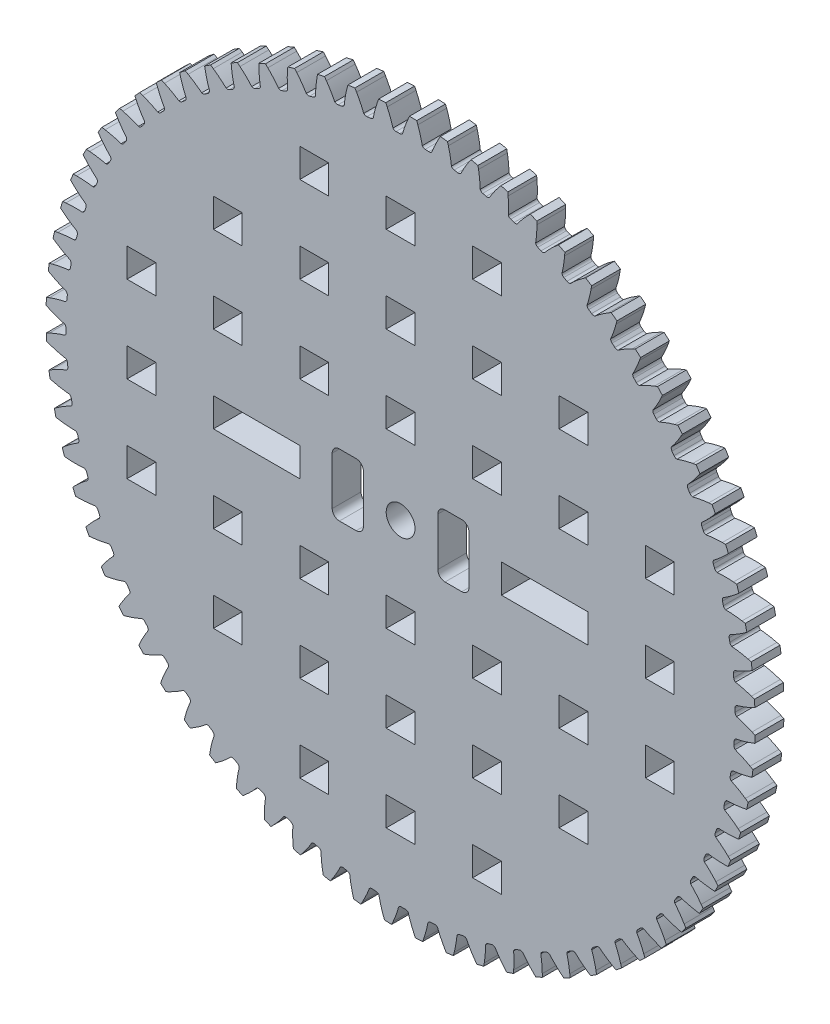
from build123d import *

# Parameters (mm, degrees)
MODEL_R                 = 1.5
MODEL_W                 = 3
MODEL_H                 = 3
MODEL_W_2               = 9
MODEL_H_2               = 2.999999999
SALIENTE_EXTRUIR1_DEPTH = 3


with BuildPart() as part:
    # Model → Saliente-Extruir1 (new body)
    with BuildSketch(Plane.XY):
        with BuildLine():
            Line((66.381105727, 280.580144611), (66.621753071, 280.825617289))
            Line((66.621753071, 280.825617289), (67.312110853, 280.546390046))
            Line((67.312110853, 280.546390046), (67.314437691, 280.202642223))
            ThreePointArc((67.314437691, 280.202642223), (67.28482772, 279.346751176), (67.187378036, 278.495910536))
            ThreePointArc((67.187378036, 278.495910536), (67.266733106, 278.333407592), (67.411213785, 278.224642857))
            Line((67.411213785, 278.224642857), (67.74822325, 278.070904418))
            ThreePointArc((67.74822325, 278.070904418), (67.925068257, 278.033085409), (68.099807783, 278.079674378))
            ThreePointArc((68.099807783, 278.079674378), (68.67849162, 278.710983536), (69.305457569, 279.294370142))
            Line((69.305457569, 279.294370142), (69.566583531, 279.517934925))
            Line((69.566583531, 279.517934925), (70.229978036, 279.17960158))
            Line((70.229978036, 279.17960158), (70.202336423, 278.836959024))
            ThreePointArc((70.202336423, 278.836959024), (70.098243307, 277.98690558), (69.9270088, 277.147795945))
            ThreePointArc((69.9270088, 277.147795945), (69.991898836, 276.978995124), (70.12635025, 276.858051951))
            Line((70.12635025, 276.858051951), (70.448678105, 276.675526223))
            ThreePointArc((70.448678105, 276.675526223), (70.62155402, 276.622438068), (70.799689105, 276.653620199))
            ThreePointArc((70.799689105, 276.653620199), (71.431193094, 277.232091415), (72.106618742, 277.758614377))
            Line((72.106618742, 277.758614377), (72.386235995, 277.958569801))
            Line((72.386235995, 277.958569801), (73.01761839, 277.563705276))
            Line((73.01761839, 277.563705276), (72.960218694, 277.224775703))
            ThreePointArc((72.960218694, 277.224775703), (72.782434645, 276.387029282), (72.538718514, 275.566036783))
            ThreePointArc((72.538718514, 275.566036783), (72.588649663, 275.392222761), (72.712048557, 275.2600216))
            Line((72.712048557, 275.2600216), (73.017241691, 275.050097714))
            ThreePointArc((73.017241691, 275.050097714), (73.184832823, 274.982144447), (73.365007753, 274.997682425))
            ThreePointArc((73.365007753, 274.997682425), (74.044525766, 275.518913184), (74.763270716, 275.984565343))
            Line((74.763270716, 275.984565343), (75.059251204, 276.159389627))
            Line((75.059251204, 276.159389627), (75.653816287, 275.710999079))
            Line((75.653816287, 275.710999079), (75.567095357, 275.378361949))
            ThreePointArc((75.567095357, 275.378361949), (75.316973418, 274.559298306), (75.002630489, 273.762671193))
            ThreePointArc((75.002630489, 273.762671193), (75.037222744, 273.585166799), (75.148629978, 273.442713781))
            Line((75.148629978, 273.442713781), (75.434365689, 273.206989384))
            ThreePointArc((75.434365689, 273.206989384), (75.595396568, 273.12468817), (75.776240102, 273.124463742))
            ThreePointArc((75.776240102, 273.124463742), (76.498600598, 273.584487163), (77.255194765, 273.985724625))
            Line((77.255194765, 273.985724625), (77.565285899, 274.13408725))
            Line((77.565285899, 274.13408725), (78.118508672, 273.635583202))
            Line((78.118508672, 273.635583202), (78.003126504, 273.311770085))
            ThreePointArc((78.003126504, 273.311770085), (77.682570254, 272.51762279), (77.299992868, 271.751423874))
            ThreePointArc((77.299992868, 271.751423874), (77.318982962, 271.571580024), (77.417550659, 271.419959303))
            Line((77.417550659, 271.419959303), (77.681654324, 271.160228401))
            ThreePointArc((77.681654324, 271.160228401), (77.834899409, 271.064205602), (78.015035218, 271.048220475))
            ThreePointArc((78.015035218, 271.048220475), (78.774740597, 271.443535503), (79.563425845, 271.777304608))
            Line((79.563425845, 271.777304608), (79.885267643, 271.898076446))
            Line((79.885267643, 271.898076446), (80.392937745, 271.353252815))
            Line((80.392937745, 271.353252815), (80.249772469, 271.040728122))
            ThreePointArc((80.249772469, 271.040728122), (79.861221535, 270.277541116), (79.413321335, 269.547601634))
            ThreePointArc((79.413321335, 269.547601634), (79.416564742, 269.366787049), (79.501542743, 269.20715255))
            Line((79.501542743, 269.20715255), (79.742004373, 268.925391851))
            ThreePointArc((79.742004373, 268.925391851), (79.886297376, 268.816378258), (80.064354519, 268.784754089))
            ThreePointArc((80.064354519, 268.784754089), (80.855622965, 269.112352138), (81.670396921, 269.376112702))
            Line((81.670396921, 269.376112702), (82.001539973, 269.468374606))
            Line((82.001539973, 269.468374606), (82.459793729, 268.881377828))
            Line((82.459793729, 268.881377828), (82.289934918, 268.582520062))
            ThreePointArc((82.289934918, 268.582520062), (81.836346408, 267.856101658), (81.326532186, 267.167976892))
            ThreePointArc((81.326532186, 267.167976892), (81.314004221, 266.987567679), (81.384745791, 266.821134316))
            Line((81.384745791, 266.821134316), (81.59973533, 266.519488189))
            ThreePointArc((81.59973533, 266.519488189), (81.733978094, 266.398313463), (81.908601447, 266.351290931))
            ThreePointArc((81.908601447, 266.351290931), (82.725410929, 266.608678781), (83.560072672, 266.800423427))
            Line((83.560072672, 266.800423427), (83.89799678, 266.863473228))
            Line((83.89799678, 266.863473228), (84.303346601, 266.238770704))
            Line((84.303346601, 266.238770704), (84.108086984, 265.955854353))
            ThreePointArc((84.108086984, 265.955854353), (83.592912979, 265.271733033), (83.025064729, 264.630660026))
            ThreePointArc((83.025064729, 264.630660026), (82.996860738, 264.452029209), (83.052827492, 264.280063642))
            Line((83.052827492, 264.280063642), (83.240708738, 263.960827797))
            ThreePointArc((83.240708738, 263.960827797), (83.363879595, 263.828414149), (83.53374017, 263.766351124))
            ThreePointArc((83.53374017, 263.766351124), (84.369874274, 263.951569898), (85.218071524, 264.069839334))
            Line((85.218071524, 264.069839334), (85.560204881, 264.103197184))
            Line((85.560204881, 264.103197184), (85.909565812, 263.445543277))
            Line((85.909565812, 263.445543277), (85.690391431, 263.180721505))
            ThreePointArc((85.690391431, 263.180721505), (85.117552718, 262.544103847), (84.495992107, 261.954961553))
            ThreePointArc((84.495992107, 261.954961553), (84.452326739, 261.779468619), (84.493092736, 261.603279609))
            Line((84.493092736, 261.603279609), (84.652435801, 261.268883623))
            ThreePointArc((84.652435801, 261.268883623), (84.763597345, 261.126238802), (84.9274024, 261.04960762))
            ThreePointArc((84.9274024, 261.04960762), (85.776497642, 261.161247692), (86.631775106, 261.205141816))
            Line((86.631775106, 261.205141816), (86.97551387, 261.208553843))
            Line((86.97551387, 261.208553843), (87.266227062, 260.522953696))
            Line((87.266227062, 260.522953696), (87.024805968, 260.278241957))
            ThreePointArc((87.024805968, 260.278241957), (86.398662194, 259.693973005), (85.728119675, 259.161245151))
            ThreePointArc((85.728119675, 259.161245151), (85.66932525, 258.990225709), (85.694580236, 258.81115416))
            Line((85.694580236, 258.81115416), (85.824172421, 258.464142989))
            ThreePointArc((85.824172421, 258.464142989), (85.922478647, 258.312352607), (86.078981527, 258.221736479))
            ThreePointArc((86.078981527, 258.221736479), (86.934575778, 258.258948201), (87.790424279, 258.228132952))
            Line((87.790424279, 258.228132952), (88.133152391, 258.201573187))
            Line((88.133152391, 258.201573187), (88.363005341, 257.493244632))
            Line((88.363005341, 257.493244632), (88.101174894, 257.270505329))
            ThreePointArc((88.101174894, 257.270505329), (87.426491391, 256.743031723), (86.712070198, 256.270772691))
            ThreePointArc((86.712070198, 256.270772691), (86.638594177, 256.105528301), (86.648145946, 255.924937056))
            Line((86.648145946, 255.924937056), (86.747000978, 255.567951664))
            ThreePointArc((86.747000978, 255.567951664), (86.831703715, 255.408170939), (86.979713338, 255.304259508))
            ThreePointArc((86.979713338, 255.304259508), (87.83529501, 255.266759675), (88.685201022, 255.161469576))
            Line((88.685201022, 255.161469576), (89.024310115, 255.105140156))
            Line((89.024310115, 255.105140156), (89.191553504, 254.379474))
            Line((89.191553504, 254.379474), (88.911306392, 254.180402315))
            ThreePointArc((88.911306392, 254.180402315), (88.193217909, 253.713738446), (87.440355217, 253.305542412))
            ThreePointArc((87.440355217, 253.305542412), (87.352756797, 253.147330684), (87.346532655, 252.966594152))
            Line((87.346532655, 252.966594152), (87.413898186, 252.602351414))
            ThreePointArc((87.413898186, 252.602351414), (87.484352796, 252.435796372), (87.62274272, 252.319380467))
            ThreePointArc((87.62274272, 252.319380467), (88.47180032, 252.207454476), (89.309295546, 252.028490847))
            Line((89.309295546, 252.028490847), (89.642204794, 251.942820474))
            Line((89.642204794, 251.942820474), (89.745565799, 251.205339474))
            Line((89.745565799, 251.205339474), (89.449034871, 251.031450462))
            ThreePointArc((89.449034871, 251.031450462), (88.693006495, 250.629147926), (87.907432045, 250.288121508))
            ThreePointArc((87.907432045, 250.288121508), (87.806377903, 250.138146529), (87.784425218, 249.958640224))
            Line((87.784425218, 249.958640224), (87.819788557, 249.589912246))
            ThreePointArc((87.819788557, 249.589912246), (87.875458838, 249.417850472), (88.003175832, 249.289816088))
            ThreePointArc((88.003175832, 249.289816088), (88.839247518, 249.104315764), (89.657958114, 248.853040628))
            Line((89.657958114, 248.853040628), (89.982133876, 248.738681303))
            Line((89.982133876, 248.738681303), (90.020825857, 247.994998136))
            Line((90.020825857, 247.994998136), (89.710267893, 247.847615198))
            ThreePointArc((89.710267893, 247.847615198), (88.922053458, 247.512735758), (88.109745944, 247.241474374))
            ThreePointArc((88.109745944, 247.241474374), (87.996005163, 247.100877544), (87.95849101, 246.923967617))
            Line((87.95849101, 246.923967617), (87.961583019, 246.553560642))
            ThreePointArc((87.961583019, 246.553560642), (88.002045286, 246.377301631), (88.118117347, 246.238623187))
            ThreePointArc((88.118117347, 246.238623187), (88.934840109, 245.980960298), (89.728535193, 245.659286009))
            Line((89.728535193, 245.659286009), (90.041510297, 245.517108077))
            Line((90.041510297, 245.517108077), (90.015238784, 244.772882621))
            Line((90.015238784, 244.772882621), (89.693017317, 244.653127429))
            ThreePointArc((89.693017317, 244.653127429), (88.87861561, 244.388219722), (88.045757184, 244.188787833))
            ThreePointArc((88.045757184, 244.188787833), (87.9201954, 244.058639179), (87.867405283, 243.885672021))
            Line((87.867405283, 243.885672021), (87.838202432, 243.516405071))
            ThreePointArc((87.838202432, 243.516405071), (87.863148743, 243.337290259), (87.966692491, 243.189023182))
            ThreePointArc((87.966692491, 243.189023182), (88.757850576, 242.8611587), (89.52048965, 242.471533394))
            Line((89.52048965, 242.471533394), (89.819882165, 242.302618914))
            Line((89.819882165, 242.302618914), (89.728847101, 241.563515174))
            Line((89.728847101, 241.563515174), (89.397414431, 241.472299138))
            ThreePointArc((89.397414431, 241.472299138), (88.56302354, 241.27937927), (87.715952758, 241.153294675))
            ThreePointArc((87.715952758, 241.153294675), (87.579525571, 241.034584706), (87.511861256, 240.866876702))
            Line((87.511861256, 240.866876702), (87.450585795, 240.50156012))
            ThreePointArc((87.450585795, 240.50156012), (87.459826293, 240.320952681), (87.550053699, 240.164225372))
            ThreePointArc((87.550053699, 240.164225372), (88.309625916, 239.768654542), (89.035404835, 239.314043504))
            Line((89.035404835, 239.314043504), (89.318936204, 239.119678017))
            Line((89.318936204, 239.119678017), (89.163830421, 238.391321018))
            Line((89.163830421, 238.391321018), (88.825708951, 238.329338348))
            ThreePointArc((88.825708951, 238.329338348), (87.977679095, 238.209874556), (87.122842676, 238.158096834))
            ThreePointArc((87.122842676, 238.158096834), (86.976588381, 238.051729005), (86.894564833, 237.890556515))
            Line((86.894564833, 237.890556515), (86.801683105, 237.531970581))
            ThreePointArc((86.801683105, 237.531970581), (86.795147465, 237.351245044), (86.871371843, 237.187250294))
            ThreePointArc((86.871371843, 237.187250294), (87.59357739, 236.72698365), (88.276972538, 236.210846743))
            Line((88.276972538, 236.210846743), (88.542484916, 235.992509489))
            Line((88.542484916, 235.992509489), (88.324488862, 235.280442468))
            Line((88.324488862, 235.280442468), (87.982251901, 235.248164888))
            ThreePointArc((87.982251901, 235.248164888), (87.127037099, 235.203066364), (86.270940865, 235.225989575))
            ThreePointArc((86.270940865, 235.225989575), (86.115972544, 235.132773409), (86.020214012, 234.979363052))
            Line((86.020214012, 234.979363052), (85.896432905, 234.630236822))
            ThreePointArc((85.896432905, 234.630236822), (85.874170866, 234.450768619), (85.935812103, 234.280754526))
            ThreePointArc((85.935812103, 234.280754526), (86.615154558, 233.759294975), (87.250964886, 233.185560313))
            Line((87.250964886, 233.185560313), (87.496437564, 232.944912969))
            Line((87.496437564, 232.944912969), (87.217210321, 232.254555187))
            Line((87.217210321, 232.254555187), (86.873462498, 232.252228349))
            ThreePointArc((86.873462498, 232.252228349), (86.017571451, 232.28183832), (85.166730811, 232.379288004))
            ThreePointArc((85.166730811, 232.379288004), (85.004227867, 232.299932933), (84.895463132, 232.155452255))
            Line((84.895463132, 232.155452255), (84.741724693, 231.81844279))
            ThreePointArc((84.741724693, 231.81844279), (84.703905684, 231.641597783), (84.750494653, 231.466858257))
            ThreePointArc((84.750494653, 231.466858257), (85.38180381, 230.88817442), (85.965190417, 230.26120847))
            Line((85.965190417, 230.26120847), (86.1887552, 230.000082509))
            Line((86.1887552, 230.000082509), (85.850421855, 229.336688004))
            Line((85.850421855, 229.336688004), (85.507779299, 229.364329617))
            ThreePointArc((85.507779299, 229.364329617), (84.657725855, 229.468422733), (83.81861622, 229.63965724))
            ThreePointArc((83.81861622, 229.63965724), (83.649815399, 229.574767204), (83.528872226, 229.440315789))
            Line((83.528872226, 229.440315789), (83.346346498, 229.117987935))
            ThreePointArc((83.346346498, 229.117987935), (83.293258343, 228.94511202), (83.324440474, 228.766976934))
            ThreePointArc((83.324440474, 228.766976934), (83.90291169, 228.135472946), (84.429434651, 227.460047298))
            Line((84.429434651, 227.460047298), (84.629390075, 227.180430045))
            Line((84.629390075, 227.180430045), (84.23452555, 226.54904765))
            Line((84.23452555, 226.54904765), (83.895595978, 226.606447345))
            ThreePointArc((83.895595978, 226.606447345), (83.057849557, 226.784231395), (82.236857058, 227.027947526))
            ThreePointArc((82.236857058, 227.027947526), (82.063043036, 226.978016377), (81.930841875, 226.854617483))
            Line((81.930841875, 226.854617483), (81.720917989, 226.549424348))
            ThreePointArc((81.720917989, 226.549424348), (81.652964722, 226.381833216), (81.6685027, 226.201658287))
            ThreePointArc((81.6685027, 226.201658287), (82.189733459, 225.522140273), (82.655385618, 224.803395324))
            Line((82.655385618, 224.803395324), (82.830209901, 224.507414835))
            Line((82.830209901, 224.507414835), (82.381819354, 223.912849752))
            Line((82.381819354, 223.912849752), (82.049182224, 223.999570683))
            ThreePointArc((82.049182224, 223.999570683), (81.230118581, 224.249692622), (80.433491468, 224.564035551))
            ThreePointArc((80.433491468, 224.564035551), (80.255987074, 224.529443295), (80.113534056, 224.418036062))
            Line((80.113534056, 224.418036062), (79.877809659, 224.132300351))
            ThreePointArc((79.877809659, 224.132300351), (79.795508445, 223.971269472), (79.795284016, 223.790425938))
            ThreePointArc((79.795284016, 223.790425938), (80.255307438, 223.068065442), (80.6565449, 222.311471274))
            Line((80.6565449, 222.311471274), (80.804907525, 222.00138014))
            Line((80.804907525, 222.00138014), (80.306403477, 221.448157368))
            Line((80.306403477, 221.448157368), (79.982590359, 221.563539536))
            ThreePointArc((79.982590359, 221.563539536), (79.188443065, 221.884095785), (78.422244149, 222.266673172))
            ThreePointArc((78.422244149, 222.266673172), (78.242400299, 222.247683078), (78.090779578, 222.149115381))
            Line((78.090779578, 222.149115381), (77.831048676, 221.885011716))
            ThreePointArc((77.831048676, 221.885011716), (77.735025877, 221.731766631), (77.71904075, 221.551630822))
            ThreePointArc((77.71904075, 221.551630822), (78.114355778, 220.791925442), (78.448124883, 220.003240195))
            Line((78.448124883, 220.003240195), (78.568896721, 219.681398397))
            Line((78.568896721, 219.681398397), (78.02407309, 219.173728295))
            Line((78.02407309, 219.173728295), (77.711548397, 219.316893571))
            ThreePointArc((77.711548397, 219.316893571), (76.94836139, 219.705444505), (76.218421909, 220.153344705))
            ThreePointArc((76.218421909, 220.153344705), (76.037607324, 220.150101298), (75.877972825, 220.065123297))
            Line((75.877972825, 220.065123297), (75.596212126, 219.824661666))
            ThreePointArc((75.596212126, 219.824661666), (75.487198533, 219.680368663), (75.455574364, 219.502311521))
            ThreePointArc((75.455574364, 219.502311521), (75.783172413, 218.711043075), (76.046932977, 217.896269119))
            Line((76.046932977, 217.896269119), (76.13919488, 217.565126067))
            Line((76.13919488, 217.565126067), (75.552198103, 217.106872311))
            Line((75.552198103, 217.106872311), (75.253340337, 217.276731122))
            ThreePointArc((75.253340337, 217.276731122), (74.526921933, 217.730319632), (73.838797166, 218.240133854))
            ThreePointArc((73.838797166, 218.240133854), (73.658387954, 218.252661819), (73.491954591, 218.181920249))
            Line((73.491954591, 218.181920249), (73.190308464, 217.96693071))
            ThreePointArc((73.190308464, 217.96693071), (73.069133738, 217.832687946), (73.022111206, 217.658064593))
            ThreePointArc((73.022111206, 217.658064593), (73.279499056, 216.841255111), (73.471243702, 216.006593368))
            Line((73.471243702, 216.006593368), (73.534293503, 215.66866926))
            Line((73.534293503, 215.66866926), (72.909590979, 215.263319438))
            Line((72.909590979, 215.263319438), (72.626674627, 215.458579056))
            ThreePointArc((72.626674627, 215.458579056), (71.942553308, 215.973753061), (71.301480301, 216.541601311))
            ThreePointArc((71.301480301, 216.541601311), (71.122849484, 216.569805302), (70.950883917, 216.513838548))
            Line((70.950883917, 216.513838548), (70.631648071, 216.325957301))
            ThreePointArc((70.631648071, 216.325957301), (70.499234424, 216.202786445), (70.437171398, 216.03292587))
            ThreePointArc((70.437171398, 216.03292587), (70.622390173, 215.196791766), (70.740659609, 214.348594515))
            Line((70.740659609, 214.348594515), (70.774017459, 214.006461159))
            Line((70.774017459, 214.006461159), (70.116363552, 213.657100228))
            Line((70.116363552, 213.657100228), (69.85154178, 213.876274608))
            ThreePointArc((69.85154178, 213.876274608), (69.214924122, 214.449113322), (68.625781828, 215.070673932))
            ThreePointArc((68.625781828, 215.070673932), (68.450288894, 215.1143393), (68.274099884, 215.073573304))
            Line((68.274099884, 215.073573304), (67.939703898, 214.914230239))
            ThreePointArc((67.939703898, 214.914230239), (67.797059077, 214.803068695), (67.720427895, 214.63926364))
            ThreePointArc((67.720427895, 214.63926364), (67.832067967, 213.790168398), (67.875962091, 212.934890934))
            Line((67.875962091, 212.934890934), (67.879374118, 212.59115217))
            Line((67.879374118, 212.59115217), (67.193773971, 212.300438977))
            Line((67.193773971, 212.300438977), (66.949062232, 212.541860071))
            ThreePointArc((66.949062232, 212.541860071), (66.364793279, 213.168003846), (65.832065426, 213.838546364))
            ThreePointArc((65.832065426, 213.838546364), (65.661045984, 213.897340789), (65.481974435, 213.872085804))
            Line((65.481974435, 213.872085804), (65.134963264, 213.742493618))
            ThreePointArc((65.134963264, 213.742493618), (64.983172882, 213.644187393), (64.892556754, 213.487684513))
            ThreePointArc((64.892556754, 213.487684513), (64.929768476, 212.632090262), (64.898953227, 211.776241761))
            Line((64.898953227, 211.776241761), (64.872393462, 211.433513649))
            Line((64.872393462, 211.433513649), (64.164064907, 211.203660698))
            Line((64.164064907, 211.203660698), (63.941325604, 211.465491146))
            ThreePointArc((63.941325604, 211.465491146), (63.413851997, 212.140174648), (62.941592966, 212.854595842))
            ThreePointArc((62.941592966, 212.854595842), (62.776348576, 212.928071863), (62.595757331, 212.918520094))
            Line((62.595757331, 212.918520094), (62.238771939, 212.819665062))
            ThreePointArc((62.238771939, 212.819665062), (62.078991213, 212.734962325), (61.975079783, 212.586952702))
            ThreePointArc((61.975079783, 212.586952702), (61.93757995, 211.73137103), (61.83228985, 210.881465017))
            Line((61.83228985, 210.881465017), (61.775960431, 210.542355925))
            Line((61.775960431, 210.542355925), (61.050294275, 210.375112536))
            Line((61.050294275, 210.375112536), (60.85122259, 210.655359648))
            ThreePointArc((60.85122259, 210.655359648), (60.384558721, 211.373448131), (59.976362687, 212.126310823))
            ThreePointArc((59.976362687, 212.126310823), (59.818150959, 212.213909243), (59.637414427, 212.220133385))
            Line((59.637414427, 212.220133385), (59.273171688, 212.152767854))
            ThreePointArc((59.273171688, 212.152767854), (59.106616647, 212.082313243), (58.990200742, 211.94392332))
            ThreePointArc((58.990200742, 211.94392332), (58.878274751, 211.09486572), (58.699311122, 210.257370493))
            Line((58.699311122, 210.257370493), (58.613640748, 209.924461246))
            Line((58.613640748, 209.924461246), (57.876159749, 209.821100241))
            Line((57.876159749, 209.821100241), (57.702270737, 210.117631169))
            ThreePointArc((57.702270737, 210.117631169), (57.2999682, 210.873659544), (56.958941783, 211.659233995))
            ThreePointArc((56.958941783, 211.659233995), (56.808966804, 211.760288137), (56.629460499, 211.782240822))
            Line((56.629460499, 211.782240822), (56.260732521, 211.746877483))
            ThreePointArc((56.260732521, 211.746877483), (56.088670747, 211.691207202), (55.960636363, 211.563490208))
            ThreePointArc((55.960636363, 211.563490208), (55.775136039, 210.727418522), (55.523860902, 209.908707925))
            Line((55.523860902, 209.908707925), (55.409501577, 209.584532163))
            Line((55.409501577, 209.584532163), (54.665818411, 209.545840182))
            Line((54.665818411, 209.545840182), (54.518435473, 209.856398147))
            ThreePointArc((54.518435473, 209.856398147), (54.183556033, 210.644612582), (53.912294648, 211.456920096))
            ThreePointArc((53.912294648, 211.456920096), (53.771697818, 211.570660877), (53.594787891, 211.60817503))
            Line((53.594787891, 211.60817503), (53.224380917, 211.60508302))
            ThreePointArc((53.224380917, 211.60508302), (53.048121906, 211.564620753), (52.909443462, 211.448548693))
            ThreePointArc((52.909443462, 211.448548693), (52.651780573, 210.631825931), (52.330106284, 209.838130846))
            Line((52.330106284, 209.838130846), (52.187928352, 209.525155743))
            Line((52.187928352, 209.525155743), (51.443702896, 209.551427255))
            Line((51.443702896, 209.551427255), (51.323947704, 209.873648723))
            ThreePointArc((51.323947704, 209.873648723), (51.059039996, 210.68805043), (50.859608108, 211.520908856))
            ThreePointArc((50.859608108, 211.520908856), (50.729459454, 211.64647064), (50.556492296, 211.699260757))
            Line((50.556492296, 211.699260757), (50.187225345, 211.728463608))
            ThreePointArc((50.187225345, 211.728463608), (50.008110534, 211.703517297), (49.859843457, 211.599973549))
            ThreePointArc((49.859843457, 211.599973549), (49.531978975, 210.808815464), (49.142353669, 210.04617639))
            Line((49.142353669, 210.04617639), (48.973439189, 209.746783875))
            Line((48.973439189, 209.746783875), (48.234335449, 209.837818939))
            Line((48.234335449, 209.837818939), (48.143119413, 210.169251609))
            ThreePointArc((48.143119413, 210.169251609), (47.950199545, 211.0036425), (47.82411495, 211.850713282))
            ThreePointArc((47.82411495, 211.850713282), (47.705404981, 211.987140469), (47.537696977, 212.054804784))
            Line((47.537696977, 212.054804784), (47.172380395, 212.116080245))
            ThreePointArc((47.172380395, 212.116080245), (46.991772955, 212.106839747), (46.835045647, 212.016612341))
            ThreePointArc((46.835045647, 212.016612341), (46.439474817, 211.257040123), (45.984863779, 210.531261205))
            Line((45.984863779, 210.531261205), (45.790498292, 210.247729835))
            Line((45.790498292, 210.247729835), (45.062141293, 210.402835619))
            Line((45.062141293, 210.402835619), (45.000158623, 210.740957089))
            ThreePointArc((45.000158623, 210.740957089), (44.880694831, 211.588986945), (44.828917109, 212.443823364))
            ThreePointArc((44.828917109, 212.443823364), (44.72254928, 212.590077659), (44.56137679, 212.672101207))
            Line((44.56137679, 212.672101207), (44.202790855, 212.764982934))
            ThreePointArc((44.202790855, 212.764982934), (44.022065319, 212.771518575), (43.858070569, 212.695294197))
            ThreePointArc((43.858070569, 212.695294197), (43.397803925, 211.97308865), (42.881667018, 211.289693502))
            Line((42.881667018, 211.289693502), (42.663329764, 211.024181124))
            Line((42.663329764, 211.024181124), (41.951262743, 211.242177178))
            Line((41.951262743, 211.242177178), (41.918985163, 211.584414139))
            ThreePointArc((41.918985163, 211.584414139), (41.873886639, 212.439628941), (41.896809849, 213.295725175))
            ThreePointArc((41.896809849, 213.295725175), (41.803593684, 213.450693496), (41.650183327, 213.546452027))
            Line((41.650183327, 213.546452027), (41.301057097, 213.670233135))
            ThreePointArc((41.301057097, 213.670233135), (41.121588894, 213.692495174), (40.951574801, 213.630853937))
            ThreePointArc((40.951574801, 213.630853937), (40.43011525, 212.951511481), (39.856380588, 212.315701154))
            Line((39.856380588, 212.315701154), (39.615733244, 212.070228476))
            Line((39.615733244, 212.070228476), (38.925375462, 212.349455719))
            Line((38.925375462, 212.349455719), (38.923048624, 212.693203542))
            ThreePointArc((38.923048624, 212.693203542), (38.952658595, 213.549094589), (39.050108279, 214.399935229))
            ThreePointArc((39.050108279, 214.399935229), (38.970753208, 214.562438173), (38.82627253, 214.671202908))
            Line((38.82627253, 214.671202908), (38.489263064, 214.824941347))
            ThreePointArc((38.489263064, 214.824941347), (38.312418057, 214.862760356), (38.137678531, 214.816171387))
            ThreePointArc((38.137678531, 214.816171387), (37.558994695, 214.184862229), (36.932028745, 213.601475623))
            Line((36.932028745, 213.601475623), (36.670902783, 213.37791084))
            Line((36.670902783, 213.37791084), (36.007508279, 213.716244185))
            Line((36.007508279, 213.716244185), (36.035149892, 214.058886741))
            ThreePointArc((36.035149892, 214.058886741), (36.139243008, 214.908940185), (36.310477514, 215.74804982))
            ThreePointArc((36.310477514, 215.74804982), (36.245587479, 215.916850641), (36.111136064, 216.037793814))
            Line((36.111136064, 216.037793814), (35.788808209, 216.220319542))
            ThreePointArc((35.788808209, 216.220319542), (35.615932295, 216.273407697), (35.437797209, 216.242225566))
            ThreePointArc((35.437797209, 216.242225566), (34.806293221, 215.66375435), (34.130867573, 215.137231388))
            Line((34.130867573, 215.137231388), (33.85125032, 214.937275964))
            Line((33.85125032, 214.937275964), (33.219867925, 215.332140489))
            Line((33.219867925, 215.332140489), (33.27726762, 215.671070062))
            ThreePointArc((33.27726762, 215.671070062), (33.45505167, 216.508816483), (33.698767801, 217.329808982))
            ThreePointArc((33.698767801, 217.329808982), (33.648836652, 217.503623004), (33.525437758, 217.635824165))
            Line((33.525437758, 217.635824165), (33.220244623, 217.845748051))
            ThreePointArc((33.220244623, 217.845748051), (33.052653491, 217.913701318), (32.872478562, 217.89816334))
            ThreePointArc((32.872478562, 217.89816334), (32.192960548, 217.376932581), (31.474215599, 216.911280422))
            Line((31.474215599, 216.911280422), (31.17823511, 216.736456138))
            Line((31.17823511, 216.736456138), (30.583670027, 217.184846686))
            Line((30.583670027, 217.184846686), (30.670390958, 217.517483816))
            ThreePointArc((30.670390958, 217.517483816), (30.920512897, 218.336547459), (31.234855826, 219.133174572))
            ThreePointArc((31.234855826, 219.133174572), (31.20026357, 219.310678966), (31.088856337, 219.453131984))
            Line((31.088856337, 219.453131984), (30.803120626, 219.688856381))
            ThreePointArc((30.803120626, 219.688856381), (30.642089746, 219.771157594), (30.461246213, 219.771382023))
            ThreePointArc((30.461246213, 219.771382023), (29.738885717, 219.311358602), (28.982291549, 218.91012114))
            Line((28.982291549, 218.91012114), (28.672200415, 218.761758515))
            Line((28.672200415, 218.761758515), (28.118977643, 219.260262563))
            Line((28.118977643, 219.260262563), (28.234359811, 219.58407568))
            ThreePointArc((28.234359811, 219.58407568), (28.55491606, 220.378222975), (28.937493447, 221.144421891))
            ThreePointArc((28.937493447, 221.144421891), (28.918503353, 221.324265741), (28.819935656, 221.475886462))
            Line((28.819935656, 221.475886462), (28.555831991, 221.735617364))
            ThreePointArc((28.555831991, 221.735617364), (28.402586906, 221.831640163), (28.222451097, 221.84762529))
            ThreePointArc((28.222451097, 221.84762529), (27.462745717, 221.452310262), (26.67406047, 221.118541157))
            Line((26.67406047, 221.118541157), (26.352218672, 220.997769319))
            Line((26.352218672, 220.997769319), (25.84454857, 221.54259295))
            Line((25.84454857, 221.54259295), (25.987713846, 221.855117643))
            ThreePointArc((25.987713846, 221.855117643), (26.37626478, 222.618304649), (26.824164979, 223.34824413))
            ThreePointArc((26.824164979, 223.34824413), (26.820921573, 223.529058716), (26.735943572, 223.688693215))
            Line((26.735943572, 223.688693215), (26.495481941, 223.970453914))
            ThreePointArc((26.495481941, 223.970453914), (26.351188938, 224.079467506), (26.173131796, 224.111091676))
            ThreePointArc((26.173131796, 224.111091676), (25.38186335, 223.783493627), (24.567089394, 223.519733063))
            Line((24.567089394, 223.519733063), (24.235946342, 223.427471159))
            Line((24.235946342, 223.427471159), (23.777692586, 224.014467937))
            Line((23.777692586, 224.014467937), (23.947551397, 224.313325703))
            ThreePointArc((23.947551397, 224.313325703), (24.401139907, 225.039744107), (24.910954129, 225.727868873))
            ThreePointArc((24.910954129, 225.727868873), (24.923482094, 225.908278086), (24.852740524, 226.074711449))
            Line((24.852740524, 226.074711449), (24.637750985, 226.376357576))
            ThreePointArc((24.637750985, 226.376357576), (24.503508221, 226.497532302), (24.328884868, 226.544554834))
            ThreePointArc((24.328884868, 226.544554834), (23.512075386, 226.287166984), (22.677413643, 226.095422337))
            Line((22.677413643, 226.095422337), (22.339489535, 226.032372537))
            Line((22.339489535, 226.032372537), (21.934139713, 226.657075061))
            Line((21.934139713, 226.657075061), (22.129399331, 226.939991412))
            ThreePointArc((22.129399331, 226.939991412), (22.644573336, 227.624112732), (23.212421586, 228.265185738))
            ThreePointArc((23.212421586, 228.265185738), (23.240625577, 228.443816556), (23.184658823, 228.615782123))
            Line((23.184658823, 228.615782123), (22.996777576, 228.935017968))
            ThreePointArc((22.996777576, 228.935017968), (22.87360672, 229.067431616), (22.703746145, 229.129494641))
            ThreePointArc((22.703746145, 229.129494641), (21.867612041, 228.944275867), (21.01941479, 228.826006431))
            Line((21.01941479, 228.826006431), (20.677281434, 228.792648581))
            Line((20.677281434, 228.792648581), (20.327920503, 229.450302488))
            Line((20.327920503, 229.450302488), (20.547094883, 229.715124259))
            ThreePointArc((20.547094883, 229.715124259), (21.119933597, 230.351741918), (21.741494207, 230.940884212))
            ThreePointArc((21.741494207, 230.940884212), (21.785159575, 231.116377145), (21.744393578, 231.292566156))
            Line((21.744393578, 231.292566156), (21.585050514, 231.626962142))
            ThreePointArc((21.585050514, 231.626962142), (21.47388897, 231.769606963), (21.310083915, 231.846238145))
            ThreePointArc((21.310083915, 231.846238145), (20.460988673, 231.734598073), (19.605711209, 231.690703949))
            Line((19.605711209, 231.690703949), (19.261972445, 231.687291922))
            Line((19.261972445, 231.687291922), (18.971259252, 232.372892069))
            Line((18.971259252, 232.372892069), (19.212680346, 232.617603808))
            ThreePointArc((19.212680346, 232.617603808), (19.838824121, 233.20187276), (20.509366639, 233.734600614))
            ThreePointArc((20.509366639, 233.734600614), (20.568161064, 233.905620056), (20.542906079, 234.084691605))
            Line((20.542906079, 234.084691605), (20.413313893, 234.431702776))
            ThreePointArc((20.413313893, 234.431702776), (20.315007667, 234.583493158), (20.158504788, 234.674109286))
            ThreePointArc((20.158504788, 234.674109286), (19.302910536, 234.636897564), (18.447062036, 234.667712813))
            Line((18.447062036, 234.667712813), (18.104333924, 234.694272578))
            Line((18.104333924, 234.694272578), (17.874480973, 235.402601133))
            Line((17.874480973, 235.402601133), (18.136311421, 235.625340435))
            ThreePointArc((18.136311421, 235.625340435), (18.810994923, 236.152814042), (19.525416117, 236.625073074))
            ThreePointArc((19.525416117, 236.625073074), (19.598892138, 236.790317464), (19.589340369, 236.970908709))
            Line((19.589340369, 236.970908709), (19.490485337, 237.327894101))
            ThreePointArc((19.490485337, 237.327894101), (19.4057826, 237.487674826), (19.257772977, 237.591586257))
            ThreePointArc((19.257772977, 237.591586257), (18.402191305, 237.62908609), (17.552285292, 237.734376189))
            Line((17.552285292, 237.734376189), (17.2131762, 237.790705609))
            Line((17.2131762, 237.790705609), (17.045932811, 238.516371765))
            Line((17.045932811, 238.516371765), (17.326179923, 238.71544345))
            ThreePointArc((17.326179923, 238.71544345), (18.044268406, 239.182107319), (18.797131097, 239.590303353))
            ThreePointArc((18.797131097, 239.590303353), (18.884729517, 239.748515081), (18.89095366, 239.929251613))
            Line((18.89095366, 239.929251613), (18.823588128, 240.293494351))
            ThreePointArc((18.823588128, 240.293494351), (18.753133518, 240.460049393), (18.614743594, 240.576465298))
            ThreePointArc((18.614743594, 240.576465298), (17.765685995, 240.688391289), (16.928190768, 240.867354917))
            Line((16.928190768, 240.867354917), (16.595281521, 240.953025291))
            Line((16.595281521, 240.953025291), (16.491920516, 241.690506291))
            Line((16.491920516, 241.690506291), (16.788451444, 241.864395302))
            ThreePointArc((16.788451444, 241.864395302), (17.544479819, 242.266697839), (18.33005427, 242.607724257))
            ThreePointArc((18.33005427, 242.607724257), (18.431108412, 242.757699236), (18.453061096, 242.937205541))
            Line((18.453061096, 242.937205541), (18.417697758, 243.305933519))
            ThreePointArc((18.417697758, 243.305933519), (18.362027477, 243.477995292), (18.234310483, 243.606029676))
            ThreePointArc((18.234310483, 243.606029676), (17.398238797, 243.791530001), (16.5795282, 244.042805137))
            Line((16.5795282, 244.042805137), (16.255352438, 244.157164462))
            Line((16.255352438, 244.157164462), (16.216660457, 244.900847629))
            Line((16.216660457, 244.900847629), (16.527218422, 245.048230567))
            ThreePointArc((16.527218422, 245.048230567), (17.315432857, 245.383110007), (18.12774037, 245.654371391))
            ThreePointArc((18.12774037, 245.654371391), (18.241481152, 245.794968221), (18.278995305, 245.971878148))
            Line((18.278995305, 245.971878148), (18.275903295, 246.342285123))
            ThreePointArc((18.275903295, 246.342285123), (18.235441028, 246.518544134), (18.119368968, 246.657222578))
            ThreePointArc((18.119368968, 246.657222578), (17.302646206, 246.914885467), (16.508951121, 247.236559755))
            Line((16.508951121, 247.236559755), (16.195976018, 247.378737688))
            Line((16.195976018, 247.378737688), (16.22224753, 248.122963144))
            Line((16.22224753, 248.122963144), (16.544468997, 248.242718336))
            ThreePointArc((16.544468997, 248.242718336), (17.358870705, 248.507626043), (18.19172913, 248.707057932))
            ThreePointArc((18.19172913, 248.707057932), (18.317290915, 248.837206586), (18.370081032, 249.010173743))
            Line((18.370081032, 249.010173743), (18.399283883, 249.379440694))
            ThreePointArc((18.399283883, 249.379440694), (18.374337572, 249.558555506), (18.270793824, 249.706822583))
            ThreePointArc((18.270793824, 249.706822583), (17.479635738, 250.034687065), (16.716996665, 250.424312371))
            Line((16.716996665, 250.424312371), (16.41760415, 250.593226851))
            Line((16.41760415, 250.593226851), (16.508639213, 251.332330591))
            Line((16.508639213, 251.332330591), (16.840071883, 251.423546627))
            ThreePointArc((16.840071883, 251.423546627), (17.674462775, 251.616466495), (18.521533557, 251.74255109))
            ThreePointArc((18.521533557, 251.74255109), (18.657960743, 251.861261059), (18.725625059, 252.028969063))
            Line((18.725625059, 252.028969063), (18.78690052, 252.394285645))
            ThreePointArc((18.78690052, 252.394285645), (18.777660022, 252.574893084), (18.687432616, 252.731620393))
            ThreePointArc((18.687432616, 252.731620393), (17.927860398, 253.127191222), (17.20208148, 253.581802261))
            Line((17.20208148, 253.581802261), (16.91855011, 253.776167748))
            Line((16.91855011, 253.776167748), (17.073655894, 254.504524747))
            Line((17.073655894, 254.504524747), (17.411777364, 254.566507417))
            ThreePointArc((17.411777364, 254.566507417), (18.25980722, 254.685971209), (19.114643638, 254.737748931))
            ThreePointArc((19.114643638, 254.737748931), (19.260897934, 254.84411676), (19.342921482, 255.00528925))
            Line((19.342921482, 255.00528925), (19.435803209, 255.363875184))
            ThreePointArc((19.435803209, 255.363875184), (19.44233885, 255.54460072), (19.366114471, 255.708595471))
            ThreePointArc((19.366114471, 255.708595471), (18.643908925, 256.168862115), (17.960513777, 256.684999022))
            Line((17.960513777, 256.684999022), (17.695001398, 256.903336276))
            Line((17.695001398, 256.903336276), (17.912997452, 257.615403297))
            Line((17.912997452, 257.615403297), (18.255234414, 257.647680877))
            ThreePointArc((18.255234414, 257.647680877), (19.110449216, 257.692779401), (19.96654545, 257.66985619))
            ThreePointArc((19.96654545, 257.66985619), (20.121513771, 257.763072356), (20.217272302, 257.916482713))
            Line((20.217272302, 257.916482713), (20.34105341, 258.265608943))
            ThreePointArc((20.34105341, 258.265608943), (20.363315449, 258.445077145), (20.301674211, 258.615091239))
            ThreePointArc((20.301674211, 258.615091239), (19.622331756, 259.13655079), (18.986521429, 259.710285452))
            Line((18.986521429, 259.710285452), (18.74104875, 259.950932796))
            Line((18.74104875, 259.950932796), (19.020275994, 260.641290578))
            Line((19.020275994, 260.641290578), (19.364023817, 260.643617416))
            ThreePointArc((19.364023817, 260.643617416), (20.219914864, 260.614007445), (21.070755504, 260.516557761))
            ThreePointArc((21.070755504, 260.516557761), (21.233258447, 260.595912831), (21.342023182, 260.74039351))
            Line((21.342023182, 260.74039351), (21.495761622, 261.077402975))
            ThreePointArc((21.495761622, 261.077402975), (21.533580631, 261.254247982), (21.486991662, 261.428987508))
            ThreePointArc((21.486991662, 261.428987508), (20.855682504, 262.007671345), (20.272295898, 262.634637295))
            Line((20.272295898, 262.634637295), (20.048731115, 262.895763256))
            Line((20.048731115, 262.895763256), (20.38706446, 263.559157761))
            Line((20.38706446, 263.559157761), (20.729707016, 263.531516148))
            ThreePointArc((20.729707016, 263.531516148), (21.57976046, 263.427423032), (22.418870094, 263.256188525))
            ThreePointArc((22.418870094, 263.256188525), (22.587670916, 263.321078561), (22.708614089, 263.455529976))
            Line((22.708614089, 263.455529976), (22.891139817, 263.777857831))
            ThreePointArc((22.891139817, 263.777857831), (22.944227972, 263.950733745), (22.913045841, 264.128868831))
            ThreePointArc((22.913045841, 264.128868831), (22.334574625, 264.760372819), (21.808051663, 265.435798467))
            Line((21.808051663, 265.435798467), (21.608096239, 265.71541572))
            Line((21.608096239, 265.71541572), (22.002960764, 266.346798115))
            Line((22.002960764, 266.346798115), (22.341890336, 266.28939842))
            ThreePointArc((22.341890336, 266.28939842), (23.179636758, 266.11161437), (24.000629256, 265.867898239))
            ThreePointArc((24.000629256, 265.867898239), (24.174443279, 265.917829388), (24.30664444, 266.041228282))
            Line((24.30664444, 266.041228282), (24.516568326, 266.346421416))
            ThreePointArc((24.516568326, 266.346421416), (24.584521593, 266.514012548), (24.568983615, 266.694187478))
            ThreePointArc((24.568983615, 266.694187478), (24.047752856, 267.373705491), (23.582100697, 268.092450441))
            Line((23.582100697, 268.092450441), (23.407276413, 268.388430929))
            Line((23.407276413, 268.388430929), (23.855666961, 268.982996013))
            Line((23.855666961, 268.982996013), (24.188304091, 268.896275082))
            ThreePointArc((24.188304091, 268.896275082), (25.007367733, 268.646153143), (25.803994847, 268.331810214))
            ThreePointArc((25.803994847, 268.331810214), (25.981499241, 268.36640247), (26.123952259, 268.477809703))
            Line((26.123952259, 268.477809703), (26.359676656, 268.763545414))
            ThreePointArc((26.359676656, 268.763545414), (26.441977869, 268.924576293), (26.442202298, 269.105419827))
            ThreePointArc((26.442202298, 269.105419827), (25.982178876, 269.827780323), (25.580941415, 270.584374491))
            Line((25.580941415, 270.584374491), (25.432578789, 270.894465625))
            Line((25.432578789, 270.894465625), (25.931082837, 271.447688397))
            Line((25.931082837, 271.447688397), (26.254895955, 271.332306229))
            ThreePointArc((26.254895955, 271.332306229), (27.04904325, 271.01174998), (27.815242166, 270.629172593))
            ThreePointArc((27.815242166, 270.629172593), (27.995086015, 270.648162687), (28.146706737, 270.746730384))
            Line((28.146706737, 270.746730384), (28.406437639, 271.010834049))
            ThreePointArc((28.406437639, 271.010834049), (28.502460438, 271.164079134), (28.518445565, 271.344214943))
            ThreePointArc((28.518445565, 271.344214943), (28.123130537, 272.103920322), (27.789361432, 272.89260557))
            Line((27.789361432, 272.89260557), (27.668589594, 273.214447368))
            Line((27.668589594, 273.214447368), (28.213413225, 273.72211747))
            Line((28.213413225, 273.72211747), (28.525937918, 273.578952194))
            ThreePointArc((28.525937918, 273.578952194), (29.289124924, 273.19040126), (30.019064405, 272.74250106))
            ThreePointArc((30.019064405, 272.74250106), (30.199878991, 272.745744467), (30.35951349, 272.830722468))
            Line((30.35951349, 272.830722468), (30.641274189, 273.071184099))
            ThreePointArc((30.641274189, 273.071184099), (30.750287781, 273.215477102), (30.78191195, 273.393534244))
            ThreePointArc((30.78191195, 273.393534244), (30.454313902, 274.18480269), (30.190553337, 274.999576646))
            Line((30.190553337, 274.999576646), (30.098291434, 275.330719698))
            Line((30.098291434, 275.330719698), (30.685288212, 275.788973454))
            Line((30.685288212, 275.788973454), (30.984145977, 275.619114643))
            ThreePointArc((30.984145977, 275.619114643), (31.710564382, 275.165526133), (32.398689148, 274.655711911))
            ThreePointArc((32.398689148, 274.655711911), (32.579098361, 274.643183946), (32.745531724, 274.713925516))
            Line((32.745531724, 274.713925516), (33.04717785, 274.928915055))
            ThreePointArc((33.04717785, 274.928915055), (33.168352577, 275.063157819), (33.215375109, 275.237781172))
            ThreePointArc((33.215375109, 275.237781172), (32.957987259, 276.054590654), (32.766242612, 276.889252397))
            Line((32.766242612, 276.889252397), (32.703192812, 277.227176505))
            Line((32.703192812, 277.227176505), (33.327895336, 277.632526326))
            Line((33.327895336, 277.632526326), (33.610811687, 277.437266709))
            ThreePointArc((33.610811687, 277.437266709), (34.294933007, 276.922092704), (34.936006013, 276.354244454))
            ThreePointArc((34.936006013, 276.354244454), (35.114636831, 276.326040463), (35.286602398, 276.382007217))
            Line((35.286602398, 276.382007217), (35.605838243, 276.569888463))
            ThreePointArc((35.605838243, 276.569888463), (35.738251891, 276.69305932), (35.800314916, 276.862919895))
            ThreePointArc((35.800314916, 276.862919895), (35.615096142, 277.699053999), (35.496826706, 278.547251249))
            Line((35.496826706, 278.547251249), (35.463468855, 278.889384606))
            Line((35.463468855, 278.889384606), (36.121122763, 279.238745537))
            Line((36.121122763, 279.238745537), (36.385944534, 279.019571156))
            ThreePointArc((36.385944534, 279.019571156), (37.022562193, 278.446732443), (37.611704487, 277.825171833))
            ThreePointArc((37.611704487, 277.825171833), (37.78719742, 277.781506465), (37.963386431, 277.822272461))
            Line((37.963386431, 277.822272461), (38.297782417, 277.981615526))
            ThreePointArc((38.297782417, 277.981615526), (38.440427238, 278.09277707), (38.517058419, 278.256582125))
            ThreePointArc((38.517058419, 278.256582125), (38.405418347, 279.105677367), (38.361524223, 279.960954831))
            Line((38.361524223, 279.960954831), (38.358112197, 280.304693595))
            Line((38.358112197, 280.304693595), (39.043712344, 280.595406787))
            Line((39.043712344, 280.595406787), (39.288424083, 280.353985693))
            ThreePointArc((39.288424083, 280.353985693), (39.872693035, 279.727841919), (40.405420889, 279.0572994))
            ThreePointArc((40.405420889, 279.0572994), (40.576440331, 278.998504975), (40.75551188, 279.023759961))
            Line((40.75551188, 279.023759961), (41.102523051, 279.153352147))
            ThreePointArc((41.102523051, 279.153352147), (41.254313433, 279.251658372), (41.34492956, 279.408161252))
            ThreePointArc((41.34492956, 279.408161252), (41.307717839, 280.263755503), (41.338533088, 281.119604004))
            Line((41.338533088, 281.119604004), (41.365092852, 281.462332116))
            Line((41.365092852, 281.462332116), (42.073421408, 281.692185066))
            Line((42.073421408, 281.692185066), (42.29616071, 281.430354619))
            ThreePointArc((42.29616071, 281.430354619), (42.823634317, 280.755671116), (43.295893349, 280.041249923))
            ThreePointArc((43.295893349, 280.041249923), (43.461137739, 279.967773902), (43.641728984, 279.977325671))
            Line((43.641728984, 279.977325671), (43.998714376, 280.076180703))
            ThreePointArc((43.998714376, 280.076180703), (44.158495101, 280.16088344), (44.262406532, 280.308893063))
            ThreePointArc((44.262406532, 280.308893063), (44.299906365, 281.164474735), (44.405196464, 282.014380748))
            Line((44.405196464, 282.014380748), (44.461525884, 282.35348984))
            Line((44.461525884, 282.35348984), (45.18719204, 282.520733229))
            Line((45.18719204, 282.520733229), (45.386263725, 282.240486117))
            ThreePointArc((45.386263725, 282.240486117), (45.852927594, 281.522397634), (46.261123628, 280.769534942))
            ThreePointArc((46.261123628, 280.769534942), (46.419335355, 280.681936522), (46.600071888, 280.67571238))
            Line((46.600071888, 280.67571238), (46.964314626, 280.743077911))
            ThreePointArc((46.964314626, 280.743077911), (47.130869668, 280.813532521), (47.247285573, 280.951922445))
            ThreePointArc((47.247285573, 280.951922445), (47.359211564, 281.800980045), (47.538175192, 282.638475272))
            Line((47.538175192, 282.638475272), (47.623845566, 282.971384519))
            Line((47.623845566, 282.971384519), (48.361326565, 283.074745524))
            Line((48.361326565, 283.074745524), (48.535215577, 282.778214596))
            ThreePointArc((48.535215577, 282.778214596), (48.937518114, 282.022186221), (49.278544532, 281.23661177))
            ThreePointArc((49.278544532, 281.23661177), (49.428519511, 281.135557628), (49.608025816, 281.113604943))
            Line((49.608025816, 281.113604943), (49.976753794, 281.148968282))
            ThreePointArc((49.976753794, 281.148968282), (50.148815567, 281.204638563), (50.276849951, 281.332355557))
            ThreePointArc((50.276849951, 281.332355557), (50.462350276, 282.168427243), (50.713625412, 282.98713784))
            Line((50.713625412, 282.98713784), (50.827984737, 283.311313601))
            Line((50.827984737, 283.311313601), (51.571667904, 283.350005582))
            Line((51.571667904, 283.350005582), (51.719050842, 283.039447618))
            ThreePointArc((51.719050842, 283.039447618), (52.053930282, 282.251233183), (52.325191666, 281.438925669))
            ThreePointArc((52.325191666, 281.438925669), (52.465788496, 281.325184888), (52.642698423, 281.287670735))
            Line((52.642698423, 281.287670735), (53.013105398, 281.290762745))
            ThreePointArc((53.013105398, 281.290762745), (53.189364409, 281.331225012), (53.328042853, 281.447297072))
            ThreePointArc((53.328042853, 281.447297072), (53.585705741, 282.264019834), (53.90738003, 283.057714919))
            Line((53.90738003, 283.057714919), (54.049557963, 283.370690022))
            Line((54.049557963, 283.370690022), (54.793783419, 283.34441851))
            Line((54.793783419, 283.34441851), (54.913538611, 283.022197042))
            ThreePointArc((54.913538611, 283.022197042), (55.178446318, 282.207795335), (55.377878206, 281.374936909))
            ThreePointArc((55.377878206, 281.374936909), (55.508026861, 281.249375125), (55.680994018, 281.196585008))
            Line((55.680994018, 281.196585008), (56.050260969, 281.167382157))
            ThreePointArc((56.050260969, 281.167382157), (56.22937578, 281.192328468), (56.377642858, 281.295872216))
            ThreePointArc((56.377642858, 281.295872216), (56.70550734, 282.087030301), (57.095132646, 282.849669375))
            Line((57.095132646, 282.849669375), (57.264047126, 283.14906189))
            Line((57.264047126, 283.14906189), (58.003150866, 283.058026826))
            Line((58.003150866, 283.058026826), (58.094366902, 282.726594156))
            ThreePointArc((58.094366902, 282.726594156), (58.28728677, 281.892203265), (58.413371365, 281.045132483))
            ThreePointArc((58.413371365, 281.045132483), (58.532081334, 280.908705296), (58.699789337, 280.841040981))
            Line((58.699789337, 280.841040981), (59.06510592, 280.77976552))
            ThreePointArc((59.06510592, 280.77976552), (59.245713359, 280.789006018), (59.402440668, 280.879233424))
            ThreePointArc((59.402440668, 280.879233424), (59.798011497, 281.638805642), (60.252622536, 282.36458456))
            Line((60.252622536, 282.36458456), (60.446988023, 282.648115929))
            Line((60.446988023, 282.648115929), (61.175345021, 282.493010146))
            Line((61.175345021, 282.493010146), (61.237327692, 282.154888676))
            ThreePointArc((61.237327692, 282.154888676), (61.356791484, 281.30685882), (61.408569206, 280.452022401))
            ThreePointArc((61.408569206, 280.452022401), (61.514937035, 280.305768106), (61.676109525, 280.223744558))
            Line((61.676109525, 280.223744558), (62.034695459, 280.130862831))
            ThreePointArc((62.034695459, 280.130862831), (62.215420995, 280.12432719), (62.379415746, 280.200551568))
            ThreePointArc((62.379415746, 280.200551568), (62.83968239, 280.922757115), (63.355819297, 281.606152263))
            Line((63.355819297, 281.606152263), (63.574156551, 281.871664641))
            Line((63.574156551, 281.871664641), (64.286223572, 281.653668587))
            Line((64.286223572, 281.653668587), (64.318501152, 281.311431626))
            ThreePointArc((64.318501152, 281.311431626), (64.363599676, 280.456216824), (64.340676465, 279.60012059))
            ThreePointArc((64.340676465, 279.60012059), (64.43389263, 279.445152269), (64.587302987, 279.349393738))
            Line((64.587302987, 279.349393738), (64.936429218, 279.22561263))
            ThreePointArc((64.936429218, 279.22561263), (65.11589742, 279.203350591), (65.285911513, 279.264991828))
            ThreePointArc((65.285911513, 279.264991828), (65.807371065, 279.944334283), (66.381105727, 280.580144611))
        make_face()
        with Locations((53.118743157, 246.447922882)):
            Circle(MODEL_R, mode=Mode.SUBTRACT)
        with Locations((44.118743157, 264.447922882)):
            Rectangle(MODEL_W, MODEL_H, mode=Mode.SUBTRACT)
        with Locations((71.118743157, 237.447922882)):
            Rectangle(MODEL_W, MODEL_H, mode=Mode.SUBTRACT)
        with Locations((71.118743157, 255.447922882)):
            Rectangle(MODEL_W, MODEL_H, mode=Mode.SUBTRACT)
        with Locations((44.118743157, 255.447922882)):
            Rectangle(MODEL_W, MODEL_H, mode=Mode.SUBTRACT)
        with Locations((53.118743157, 255.447922882)):
            Rectangle(MODEL_W, MODEL_H, mode=Mode.SUBTRACT)
        with Locations((62.118743157, 255.447922882)):
            Rectangle(MODEL_W, MODEL_H, mode=Mode.SUBTRACT)
        with Locations((44.118743157, 237.447922882)):
            Rectangle(MODEL_W, MODEL_H, mode=Mode.SUBTRACT)
        with Locations((53.118743157, 237.447922882)):
            Rectangle(MODEL_W, MODEL_H, mode=Mode.SUBTRACT)
        with Locations((62.118743157, 237.447922882)):
            Rectangle(MODEL_W, MODEL_H, mode=Mode.SUBTRACT)
        with Locations((44.118743157, 228.447922882)):
            Rectangle(MODEL_W, MODEL_H, mode=Mode.SUBTRACT)
        with Locations((53.118743157, 228.447922882)):
            Rectangle(MODEL_W, MODEL_H, mode=Mode.SUBTRACT)
        with Locations((62.118743157, 228.447922882)):
            Rectangle(MODEL_W, MODEL_H, mode=Mode.SUBTRACT)
        with Locations((35.118743157, 237.447922882)):
            Rectangle(MODEL_W, MODEL_H, mode=Mode.SUBTRACT)
        with Locations((35.118743157, 255.447922882)):
            Rectangle(MODEL_W, MODEL_H, mode=Mode.SUBTRACT)
        with Locations((38.118743157, 246.447922882)):
            Rectangle(MODEL_W_2, MODEL_H, mode=Mode.SUBTRACT)
        with Locations((62.118743157, 273.447922882)):
            Rectangle(MODEL_W, MODEL_H_2, mode=Mode.SUBTRACT)
        with Locations((53.118743157, 273.447922882)):
            Rectangle(MODEL_W, MODEL_H_2, mode=Mode.SUBTRACT)
        with Locations((44.118743157, 273.447922882)):
            Rectangle(MODEL_W, MODEL_H_2, mode=Mode.SUBTRACT)
        with Locations((26.118743157, 255.447922882)):
            Rectangle(MODEL_W, MODEL_H, mode=Mode.SUBTRACT)
        with Locations((26.118743157, 246.447922882)):
            Rectangle(MODEL_W, MODEL_H, mode=Mode.SUBTRACT)
        with Locations((26.118743157, 237.447922882)):
            Rectangle(MODEL_W, MODEL_H, mode=Mode.SUBTRACT)
        with Locations((44.118743157, 219.447922882)):
            Rectangle(MODEL_W, MODEL_H, mode=Mode.SUBTRACT)
        with Locations((53.118743157, 219.447922882)):
            Rectangle(MODEL_W, MODEL_H, mode=Mode.SUBTRACT)
        with Locations((62.118743157, 219.447922882)):
            Rectangle(MODEL_W, MODEL_H, mode=Mode.SUBTRACT)
        with Locations((80.118743157, 237.447922882)):
            Rectangle(MODEL_W, MODEL_H, mode=Mode.SUBTRACT)
        with Locations((80.118743157, 246.447922882)):
            Rectangle(MODEL_W, MODEL_H, mode=Mode.SUBTRACT)
        with Locations((80.118743157, 255.447922882)):
            Rectangle(MODEL_W, MODEL_H, mode=Mode.SUBTRACT)
        with Locations((35.118743157, 264.447922882)):
            Rectangle(MODEL_W, MODEL_H, mode=Mode.SUBTRACT)
        with Locations((35.118743157, 228.447922882)):
            Rectangle(MODEL_W, MODEL_H, mode=Mode.SUBTRACT)
        with Locations((71.118743157, 264.447922882)):
            Rectangle(MODEL_W, MODEL_H, mode=Mode.SUBTRACT)
        with Locations((71.118743157, 228.447922882)):
            Rectangle(MODEL_W, MODEL_H, mode=Mode.SUBTRACT)
        with Locations((53.118743157, 264.447922882)):
            Rectangle(MODEL_W, MODEL_H, mode=Mode.SUBTRACT)
        with Locations((68.118743157, 246.447922882)):
            Rectangle(MODEL_W_2, MODEL_H, mode=Mode.SUBTRACT)
        with Locations((62.118743157, 264.447922882)):
            Rectangle(MODEL_W, MODEL_H, mode=Mode.SUBTRACT)
        with BuildLine():
            Line((59.493743157, 249.697922882), (57.743743157, 249.697922882))
            ThreePointArc((57.743743157, 249.697922882), (57.213413071, 249.478252968), (56.993743157, 248.947922882))
            Line((56.993743157, 248.947922882), (56.993743157, 243.947922882))
            ThreePointArc((56.993743157, 243.947922882), (57.213413071, 243.417592797), (57.743743157, 243.197922882))
            Line((57.743743157, 243.197922882), (59.493743157, 243.197922882))
            ThreePointArc((59.493743157, 243.197922882), (60.024073243, 243.417592797), (60.243743157, 243.947922882))
            Line((60.243743157, 243.947922882), (60.243743157, 248.947922882))
            ThreePointArc((60.243743157, 248.947922882), (60.024073243, 249.478252968), (59.493743157, 249.697922882))
        make_face(mode=Mode.SUBTRACT)
        with BuildLine():
            Line((46.743743157, 249.697922882), (48.493743157, 249.697922882))
            ThreePointArc((48.493743157, 249.697922882), (49.024073243, 249.478252968), (49.243743157, 248.947922882))
            Line((49.243743157, 248.947922882), (49.243743157, 243.947922882))
            ThreePointArc((49.243743157, 243.947922882), (49.024073243, 243.417592797), (48.493743157, 243.197922882))
            Line((48.493743157, 243.197922882), (46.743743157, 243.197922882))
            ThreePointArc((46.743743157, 243.197922882), (46.213413071, 243.417592797), (45.993743157, 243.947922882))
            Line((45.993743157, 243.947922882), (45.993743157, 248.947922882))
            ThreePointArc((45.993743157, 248.947922882), (46.213413071, 249.478252968), (46.743743157, 249.697922882))
        make_face(mode=Mode.SUBTRACT)
    extrude(amount=SALIENTE_EXTRUIR1_DEPTH)


solid = part.part
